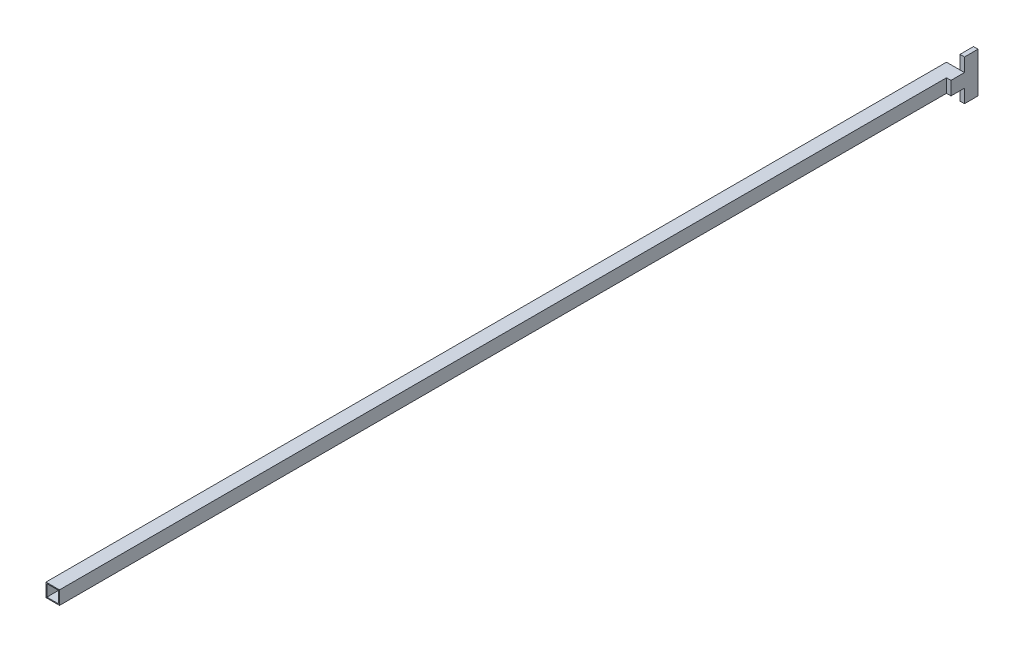
from build123d import *

# Parameters (mm, degrees)
SKETCH1_W           = 30
SKETCH1_H           = 30
SKETCH1_W_2         = 26
SKETCH1_H_2         = 26
BOSS_EXTRUDE1_DEPTH = 2000
BOSS_EXTRUDE2_DEPTH = 10


with BuildPart() as part:
    # Sketch1 → Boss-Extrude1 (new body)
    with BuildSketch(Plane.XY):
        Rectangle(SKETCH1_W, SKETCH1_H)
        Rectangle(SKETCH1_W_2, SKETCH1_H_2, mode=Mode.SUBTRACT)
    extrude(amount=BOSS_EXTRUDE1_DEPTH)

    # Sketch2 → Boss-Extrude2 (add)
    with BuildSketch(Plane(origin=(15, 0, 0), x_dir=(0, 0, -1), z_dir=(1, 0, 0))):
        Polygon((-30, 15), (0, 15), (0, 45), (30, 45), (30, 15), (30, -15), (30, -45), (0, -45), (0, -15), (-30, -15), align=None)
    extrude(amount=BOSS_EXTRUDE2_DEPTH)


solid = part.part
